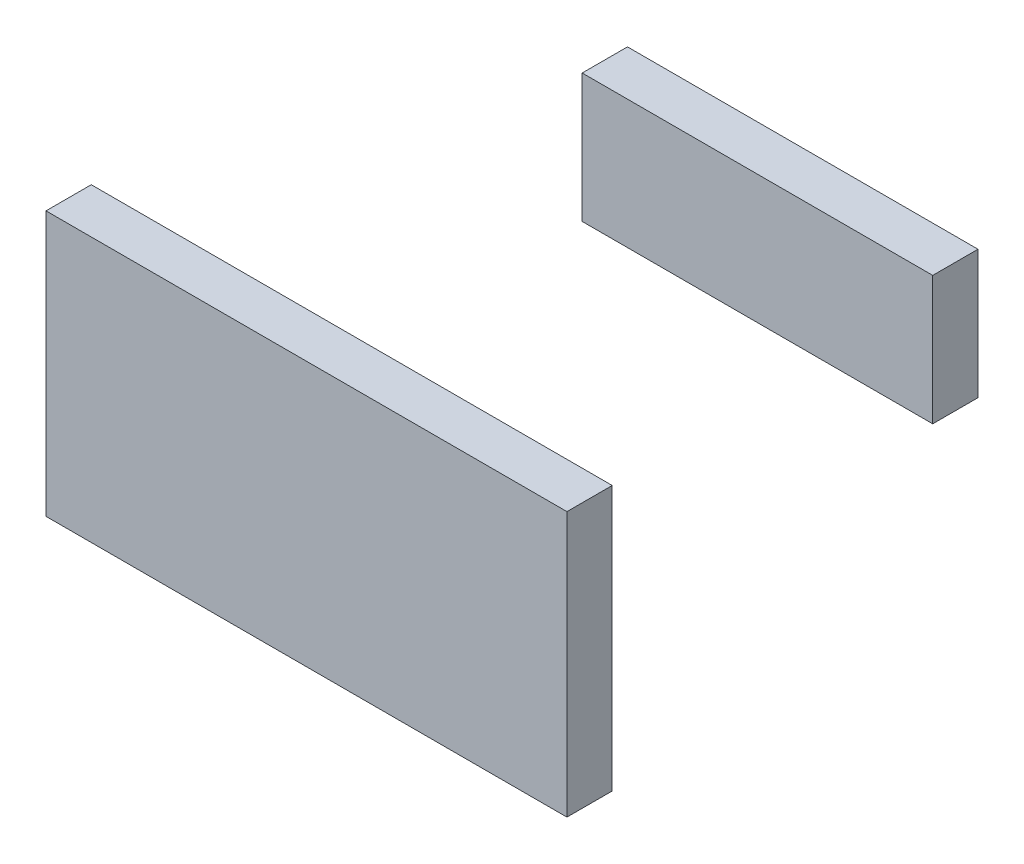
from build123d import *

# Parameters (mm, degrees)
ESQUISSE2_W        = 115.063292794
ESQUISSE2_H        = 58.444847134
BOSS_EXTRU_1_DEPTH = 10
ESQUISSE3_W        = 77.422409309
ESQUISSE3_H        = 28.401365068
BOSS_EXTRU_2_DEPTH = 10


with BuildPart() as part:
    # Esquisse2 → Boss.-Extru.1 (new body)
    with BuildSketch(Plane.XY.offset(50)):
        with Locations((8.584086923, 1.00452081)):
            Rectangle(ESQUISSE2_W, ESQUISSE2_H)
    extrude(amount=BOSS_EXTRU_1_DEPTH)


with BuildPart() as body_2:
    # Esquisse3 → Boss.-Extru.2 (new body)
    with BuildSketch(Plane.XY.offset(-50)):
        with Locations((8.198484022, 1.612162963)):
            Rectangle(ESQUISSE3_W, ESQUISSE3_H)
    extrude(amount=BOSS_EXTRU_2_DEPTH)


solid = Compound([part.part, body_2.part])
